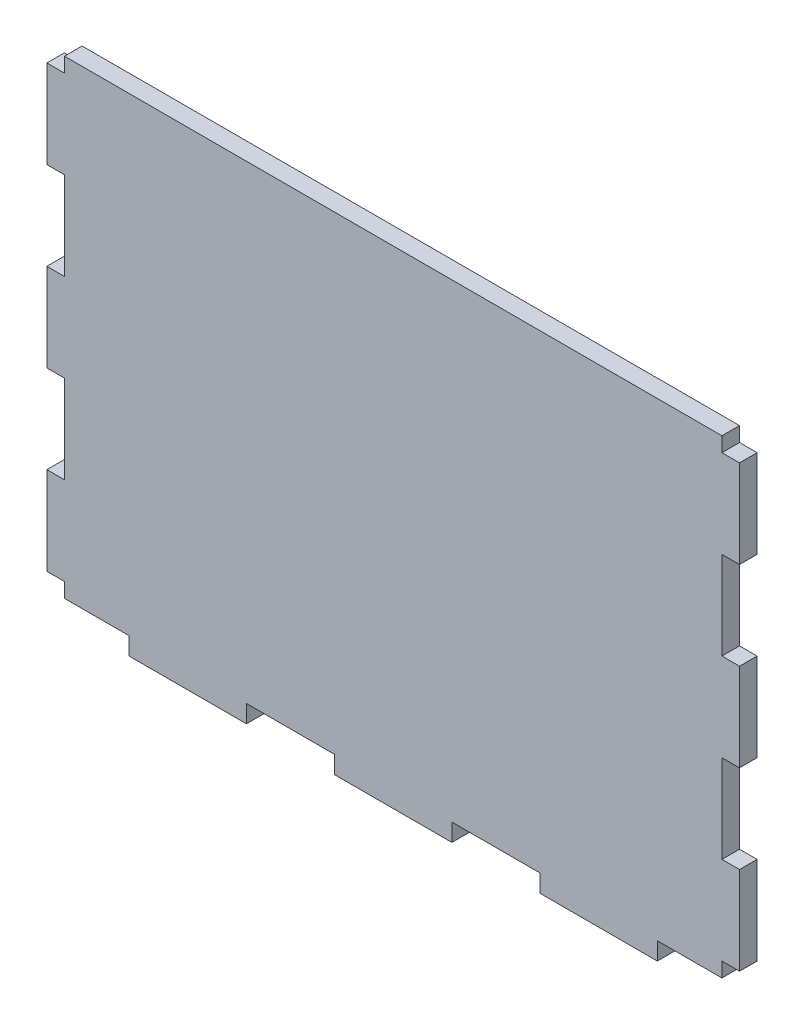
from build123d import *

# Parameters (mm, degrees)
SKETCH2_W           = 112
SKETCH2_H           = 80
SKETCH2_W_2         = 20
SKETCH2_H_2         = 3
SKETCH2_W_3         = 3
SKETCH2_H_3         = 15
BOSS_EXTRUDE1_DEPTH = 3


with BuildPart() as part:
    # Sketch2 → Boss-Extrude1 (new body)
    with BuildSketch(Plane.XY):
        Rectangle(SKETCH2_W, SKETCH2_H)
        with Locations((-35, -41.5)):
            Rectangle(SKETCH2_W_2, SKETCH2_H_2)
        with Locations((0, -41.5)):
            Rectangle(SKETCH2_W_2, SKETCH2_H_2)
        with Locations((35, -41.5)):
            Rectangle(SKETCH2_W_2, SKETCH2_H_2)
        with Locations((57.5, -30)):
            Rectangle(SKETCH2_W_3, SKETCH2_H_3)
        with Locations((-57.5, -30)):
            Rectangle(SKETCH2_W_3, SKETCH2_H_3)
        with Locations((-57.5, 0)):
            Rectangle(SKETCH2_W_3, SKETCH2_H_3)
        with Locations((57.5, 0)):
            Rectangle(SKETCH2_W_3, SKETCH2_H_3)
        with Locations((-57.5, 30)):
            Rectangle(SKETCH2_W_3, SKETCH2_H_3)
        with Locations((57.5, 30)):
            Rectangle(SKETCH2_W_3, SKETCH2_H_3)
    extrude(amount=BOSS_EXTRUDE1_DEPTH)


solid = part.part
